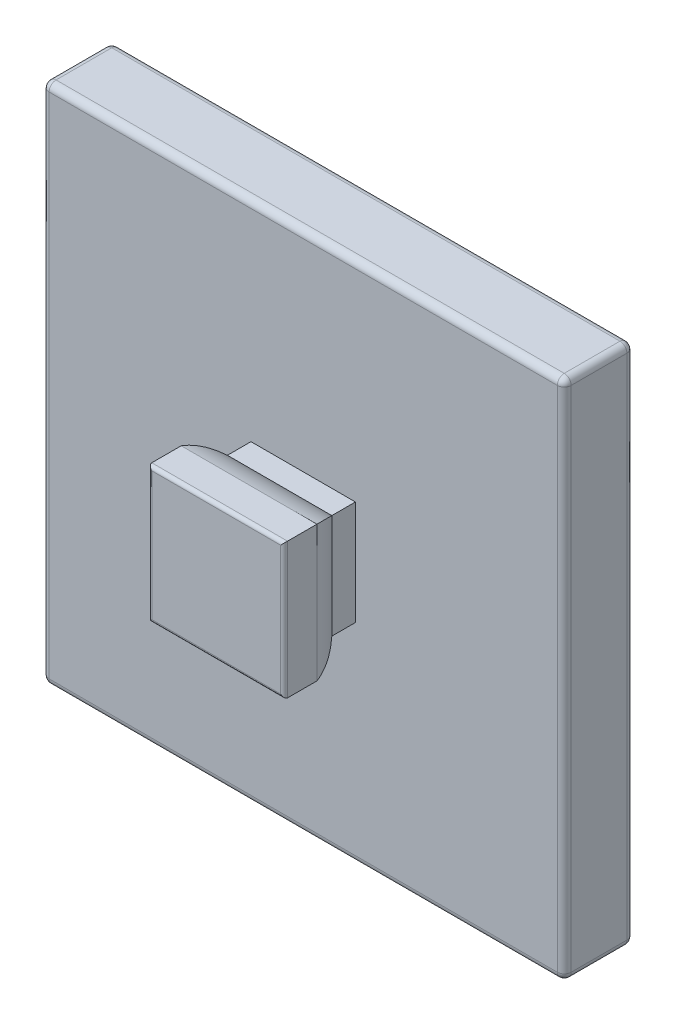
from build123d import *

# Parameters (mm, degrees)
SKETCH_1_W                      = 15
SKETCH_1_H                      = 15
EXTRUDE_1_DEPTH                 = 2
SKETCH_2_W                      = 3
SKETCH_2_H                      = 3
EXTRUDE_2_DEPTH                 = 1
EXTRUDE_3_DEPTH                 = 2
EXTRUDE_3_DEPTH_BACK            = 2
CUT_EXTRUDE_1_REACH             = 12.897
CUT_EXTRUDE_1_DIRECTION_2_REACH = 12.897
FILLET_1_R                      = 0.1
FILLET_2_R                      = 0.2


with BuildPart() as part:
    # 草图1 → 凸台-拉伸1 (new body)
    with BuildSketch(Plane.XY):
        Rectangle(SKETCH_1_W, SKETCH_1_H)
    extrude(amount=-EXTRUDE_1_DEPTH)

    # 草图2 → 凸台-拉伸2 (add)
    with BuildSketch(Plane.XY):
        Rectangle(SKETCH_2_W, SKETCH_2_H)
    extrude(amount=EXTRUDE_2_DEPTH)

    # 草图3 → 凸台-拉伸3 (add, two sides: drawn at the far end of the back side and taken through both)
    with BuildSketch(Plane(origin=(0, 0, 0), x_dir=(1, 0, 0), z_dir=(0, 1, 0)).offset(-EXTRUDE_3_DEPTH_BACK)):
        with BuildLine():
            Line((-1.95, -2.5), (1.95, -2.5))
            Line((1.95, -2.5), (1.95, -1.555590279))
            ThreePointArc((1.95, -1.555590279), (1.780042303, -1.088161527), (1.5, -0.677124344))
            Line((1.5, -0.677124344), (-1.5, -0.677124344))
            ThreePointArc((-1.5, -0.677124344), (-1.780042303, -1.088161527), (-1.95, -1.555590279))
            Line((-1.95, -1.555590279), (-1.95, -2.5))
        make_face()
    extrude(amount=EXTRUDE_3_DEPTH + EXTRUDE_3_DEPTH_BACK)

    # 草图4 → 切除-拉伸1 (cut, up to next)
    with BuildSketch(Plane(origin=(0, 0, 0), x_dir=(0, 0, -1), z_dir=(1, 0, 0)), mode=Mode.PRIVATE) as cut_extrude_1_sk1:
        with BuildLine():
            Line((-2.5, 1.95), (-1.555590279, 1.95))
            ThreePointArc((-1.555590279, 1.95), (-1.088161527, 1.780042303), (-0.677124344, 1.5))
            Line((-0.677124344, 1.5), (-0.677124344, 2))
            Line((-0.677124344, 2), (-2.5, 2))
            Line((-2.5, 2), (-2.5, 1.95))
        make_face()
    cut_extrude_1_tool1 = extrude(cut_extrude_1_sk1.sketch, amount=-CUT_EXTRUDE_1_REACH, mode=Mode.PRIVATE) & part.part
    # 草图4 → 切除-拉伸1 (cut, up to next)
    with BuildSketch(Plane(origin=(0, 0, 0), x_dir=(0, 0, -1), z_dir=(1, 0, 0)), mode=Mode.PRIVATE) as cut_extrude_1_sk2:
        with BuildLine():
            Line((-2.5, -2), (-0.677124344, -2))
            Line((-0.677124344, -2), (-0.677124344, -1.5))
            ThreePointArc((-0.677124344, -1.5), (-1.088161527, -1.780042303), (-1.555590279, -1.95))
            Line((-1.555590279, -1.95), (-2.5, -1.95))
            Line((-2.5, -1.95), (-2.5, -2))
        make_face()
    cut_extrude_1_tool2 = extrude(cut_extrude_1_sk2.sketch, amount=-CUT_EXTRUDE_1_REACH, mode=Mode.PRIVATE) & part.part
    add(cut_extrude_1_tool1.solids().sort_by_distance((0, 1.873038, 1.175075))[0], mode=Mode.SUBTRACT)
    add(cut_extrude_1_tool2.solids().sort_by_distance((0, -1.873038, 1.175075))[0], mode=Mode.SUBTRACT)

    # 草图4 → 切除-拉伸1 direction 2 (cut, up to next)
    with BuildSketch(Plane(origin=(0, 0, 0), x_dir=(0, 0, -1), z_dir=(1, 0, 0)), mode=Mode.PRIVATE) as cut_extrude_1_direction_2_sk1:
        with BuildLine():
            Line((-2.5, 1.95), (-1.555590279, 1.95))
            ThreePointArc((-1.555590279, 1.95), (-1.088161527, 1.780042303), (-0.677124344, 1.5))
            Line((-0.677124344, 1.5), (-0.677124344, 2))
            Line((-0.677124344, 2), (-2.5, 2))
            Line((-2.5, 2), (-2.5, 1.95))
        make_face()
    cut_extrude_1_direction_2_tool1 = extrude(cut_extrude_1_direction_2_sk1.sketch, amount=CUT_EXTRUDE_1_DIRECTION_2_REACH, mode=Mode.PRIVATE) & part.part
    # 草图4 → 切除-拉伸1 direction 2 (cut, up to next)
    with BuildSketch(Plane(origin=(0, 0, 0), x_dir=(0, 0, -1), z_dir=(1, 0, 0)), mode=Mode.PRIVATE) as cut_extrude_1_direction_2_sk2:
        with BuildLine():
            Line((-2.5, -2), (-0.677124344, -2))
            Line((-0.677124344, -2), (-0.677124344, -1.5))
            ThreePointArc((-0.677124344, -1.5), (-1.088161527, -1.780042303), (-1.555590279, -1.95))
            Line((-1.555590279, -1.95), (-2.5, -1.95))
            Line((-2.5, -1.95), (-2.5, -2))
        make_face()
    cut_extrude_1_direction_2_tool2 = extrude(cut_extrude_1_direction_2_sk2.sketch, amount=CUT_EXTRUDE_1_DIRECTION_2_REACH, mode=Mode.PRIVATE) & part.part
    add(cut_extrude_1_direction_2_tool1.solids().sort_by_distance((0, 1.873038, 1.175075))[0], mode=Mode.SUBTRACT)
    add(cut_extrude_1_direction_2_tool2.solids().sort_by_distance((0, -1.873038, 1.175075))[0], mode=Mode.SUBTRACT)

    # 圆角1
    fillet_1_edges = [part.edges().sort_by_distance(p)[0] for p in [
        (-1.95, 0, 2.5),
        (1.95, 0, 2.5),
        (0, -1.95, 2.5),
        (0, 1.95, 2.5),
    ]]
    fillet(fillet_1_edges, radius=FILLET_1_R)

    # 圆角2
    fillet_2_edges = [part.edges().sort_by_distance(p)[0] for p in [
        (7.5, 0, -2),
        (0, 7.5, -2),
        (-7.5, 0, -2),
        (0, 7.5, 0),
        (7.5, 0, 0),
        (0, -7.5, 0),
        (-7.5, 0, 0),
        (0, -7.5, -2),
        (-7.5, 7.5, -1),
        (7.5, 7.5, -1),
        (7.5, -7.5, -1),
        (-7.5, -7.5, -1),
    ]]
    fillet(fillet_2_edges, radius=FILLET_2_R)


solid = part.part
